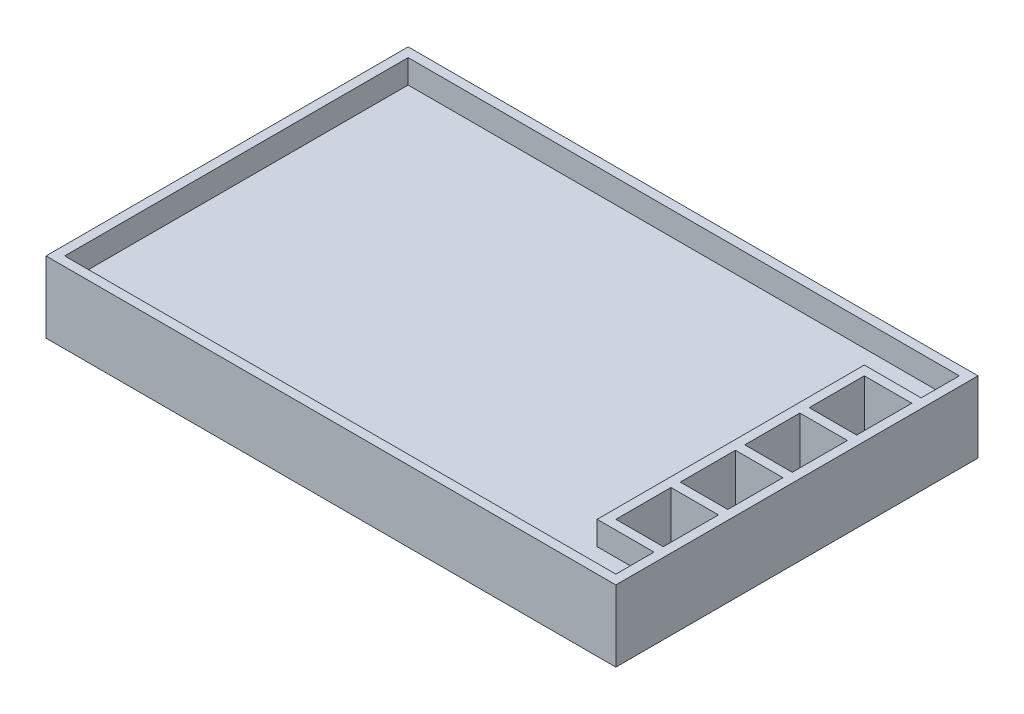
from build123d import *

# Parameters (mm, degrees)
SKETCH1_W           = 609.6
SKETCH1_H           = 387.4
BOSS_EXTRUDE1_DEPTH = 76.2
SKETCH2_W           = 589.6
SKETCH2_H           = 367.4
CUT_EXTRUDE1_DEPTH  = 25.4
SKETCH3_W           = 50.8
SKETCH3_H           = 58.95
CUT_EXTRUDE2_DEPTH  = 35.8
BOSS_EXTRUDE2_DEPTH = 25.4


with BuildPart() as part:
    # Sketch1 → Boss-Extrude1 (new body)
    with BuildSketch(Plane(origin=(0, 0, 0), x_dir=(1, 0, 0), z_dir=(0, 1, 0))):
        with Locations((32.357180973, 74.716472916)):
            Rectangle(SKETCH1_W, SKETCH1_H)
    extrude(amount=-BOSS_EXTRUDE1_DEPTH)

    # Sketch2 → Cut-Extrude1 (cut)
    with BuildSketch(Plane(origin=(0, 0, 0), x_dir=(1, 0, 0), z_dir=(0, 1, 0))):
        with Locations((32.357180973, 74.716472916)):
            Rectangle(SKETCH2_W, SKETCH2_H)
    extrude(amount=-CUT_EXTRUDE1_DEPTH, mode=Mode.SUBTRACT)

    # Sketch3 → Cut-Extrude2 (cut)
    with BuildSketch(Plane(origin=(0, -25.4, 0), x_dir=(1, 0, 0), z_dir=(0, 1, 0))):
        with Locations((301.757180973, 178.141472916)):
            Rectangle(SKETCH3_W, SKETCH3_H)
        with Locations((301.757180973, 109.191472916)):
            Rectangle(SKETCH3_W, SKETCH3_H)
        with Locations((301.757180973, 40.241472916)):
            Rectangle(SKETCH3_W, SKETCH3_H)
        with Locations((301.757180973, -28.708527084)):
            Rectangle(SKETCH3_W, SKETCH3_H)
    extrude(amount=-CUT_EXTRUDE2_DEPTH, mode=Mode.SUBTRACT)

    # Sketch7 → Boss-Extrude2 (add)
    with BuildSketch(Plane(origin=(0, -25.4, 0), x_dir=(1, 0, 0), z_dir=(0, 1, 0))):
        Polygon((327.157180973, 217.616472916), (266.357180973, 217.616472916), (266.357180973, -68.183527084), (327.157180973, -68.183527084), (327.157180973, -58.183527084), (276.357180973, -58.183527084), (276.357180973, 0.766472916), (327.157180973, 0.766472916), (327.157180973, 10.766472916), (276.357180973, 10.766472916), (276.357180973, 69.716472916), (327.157180973, 69.716472916), (327.157180973, 79.716472916), (276.357180973, 79.716472916), (276.357180973, 138.666472916), (327.157180973, 138.666472916), (327.157180973, 148.666472916), (276.357180973, 148.666472916), (276.357180973, 207.616472916), (327.157180973, 207.616472916), align=None)
    extrude(amount=BOSS_EXTRUDE2_DEPTH)


solid = part.part
